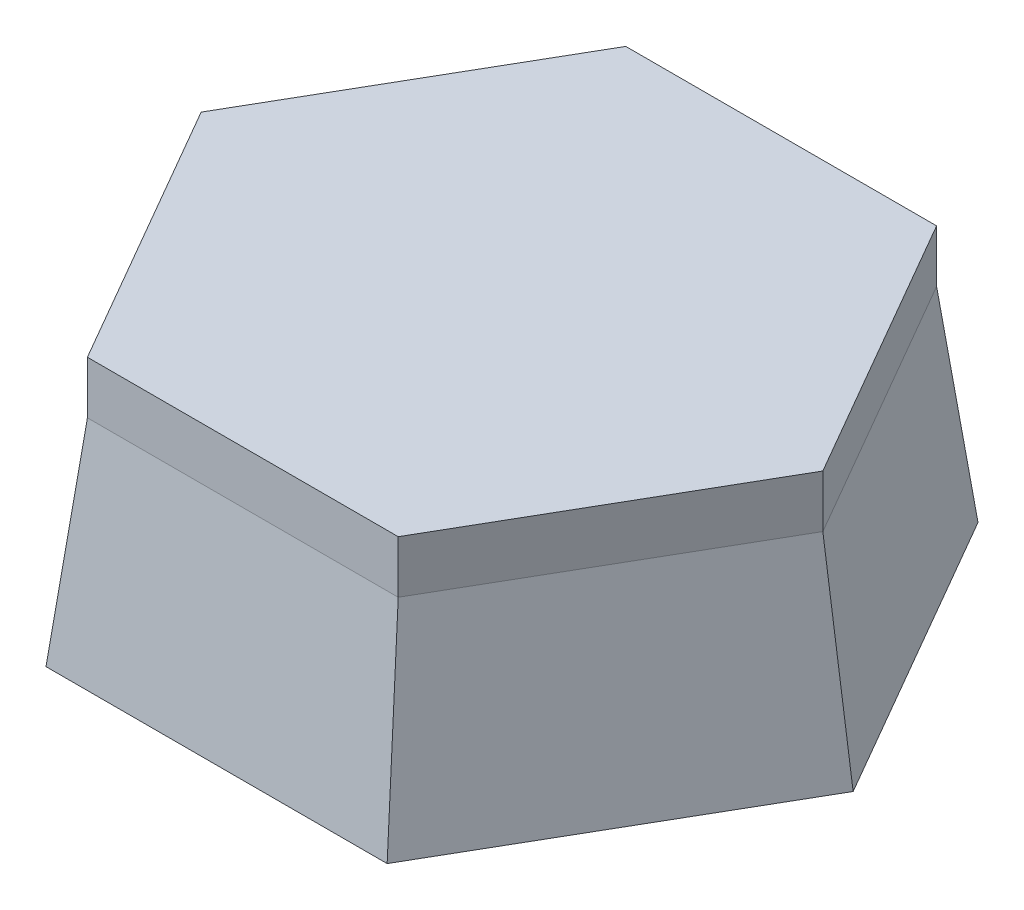
from build123d import *

# Parameters (mm, degrees)
BOSS_EXTRUDE1_DEPTH = 4


with BuildPart() as part:
    # Sketch2 → Loft1 section 0
    with BuildSketch(Plane(origin=(0, 16, 0), x_dir=(1, 0, 0), z_dir=(0, 1, 0))):
        with BuildLine():
            Line((23.69, 0), (11.845, 20.516141816))
            Line((11.845, 20.516141816), (-11.845, 20.516141816))
            Line((-11.845, 20.516141816), (-23.69, 0))
            Line((-23.69, 0), (-11.845, -20.516141816))
            Line((-11.845, -20.516141816), (11.845, -20.516141816))
            Line((11.845, -20.516141816), (23.69, 0))
        make_face()
    # Sketch1 → Loft1 section 1
    with BuildSketch(Plane(origin=(0, 0, 0), x_dir=(1, 0, 0), z_dir=(0, 1, 0))):
        with BuildLine():
            Line((26, 0), (13, 22.516660498))
            Line((13, 22.516660498), (-13, 22.516660498))
            Line((-13, 22.516660498), (-26, 0))
            Line((-26, 0), (-13, -22.516660498))
            Line((-13, -22.516660498), (13, -22.516660498))
            Line((13, -22.516660498), (26, 0))
        make_face()
    loft()

    # Sketch3 → Boss-Extrude1 (add)
    with BuildSketch(Plane(origin=(0, 16, 0), x_dir=(1, 0, 0), z_dir=(0, 1, 0))):
        Polygon((23.69, 0), (11.845, 20.516141816), (-11.845, 20.516141816), (-23.69, 0), (-11.845, -20.516141816), (11.845, -20.516141816), align=None)
    extrude(amount=BOSS_EXTRUDE1_DEPTH)

    # Sketch5 → Cut-Loft1 section 0
    with BuildSketch(Plane(origin=(0, 16, 0), x_dir=(-1, 0, 0), z_dir=(0, -1, 0))):
        with BuildLine():
            Line((20.69, 0), (10.345, 17.918065604))
            Line((10.345, 17.918065604), (-10.345, 17.918065604))
            Line((-10.345, 17.918065604), (-20.69, 0))
            Line((-20.69, 0), (-10.345, -17.918065604))
            Line((-10.345, -17.918065604), (10.345, -17.918065604))
            Line((10.345, -17.918065604), (20.69, 0))
        make_face()
    # Sketch4 → Cut-Loft1 section 1
    with BuildSketch(Plane(origin=(0, -2, 0), x_dir=(-1, 0, 0), z_dir=(0, -1, 0))):
        with BuildLine():
            Line((23, 0), (11.5, 19.918584287))
            Line((11.5, 19.918584287), (-11.5, 19.918584287))
            Line((-11.5, 19.918584287), (-23, 0))
            Line((-23, 0), (-11.5, -19.918584287))
            Line((-11.5, -19.918584287), (11.5, -19.918584287))
            Line((11.5, -19.918584287), (23, 0))
        make_face()
    loft(mode=Mode.SUBTRACT)


solid = part.part
